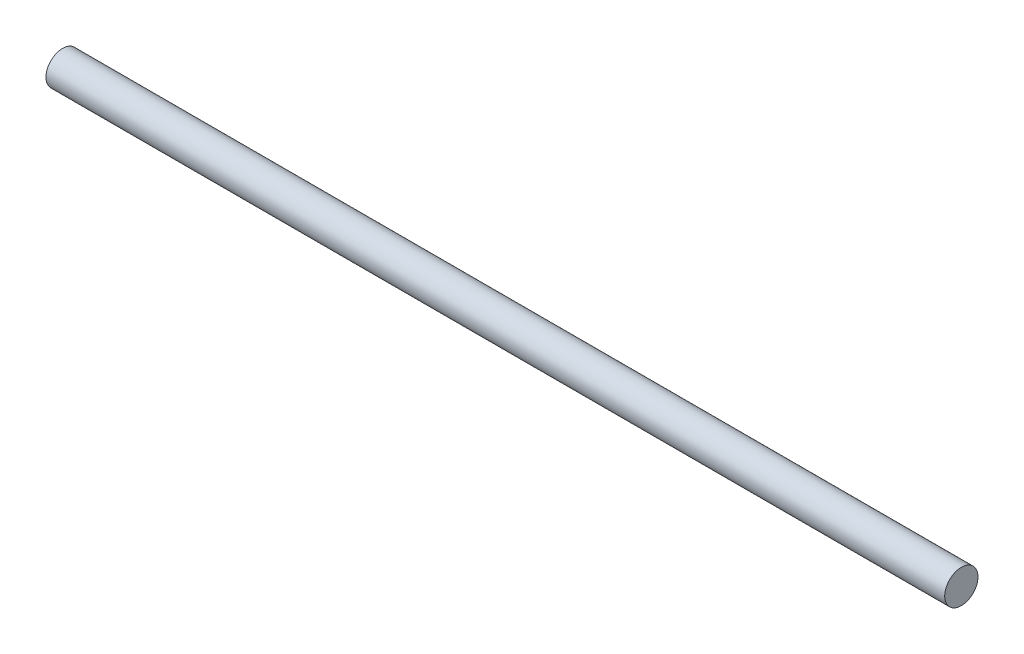
from build123d import *

# Parameters (mm, degrees)
SKETCH1_R           = 2.5
BOSS_EXTRUDE1_DEPTH = 135


with BuildPart() as part:
    # Sketch1 → Boss-Extrude1 (new body)
    with BuildSketch(Plane(origin=(0, 0, 0), x_dir=(0, 0, -1), z_dir=(1, 0, 0))):
        Circle(SKETCH1_R)
    extrude(amount=BOSS_EXTRUDE1_DEPTH)


solid = part.part
